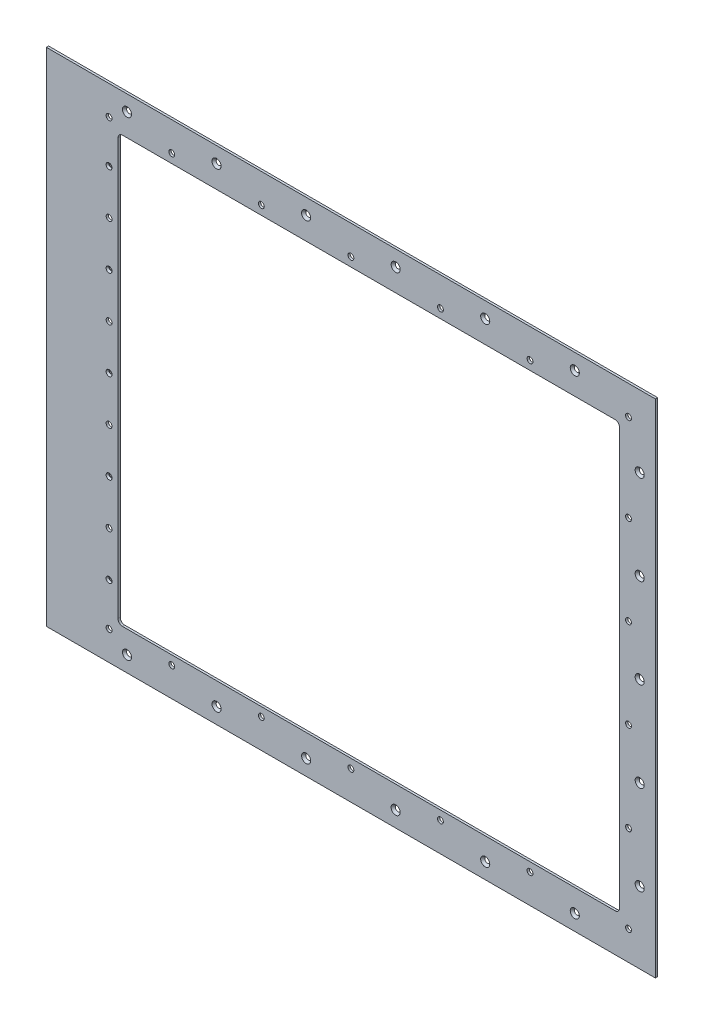
from build123d import *

# Parameters (mm, degrees)
SKETCH2_W                        = 863.6
SKETCH2_H                        = 711.2
BOSS_EXTRUDE1_DEPTH              = 3.175
SKETCH3_W                        = 711.2
SKETCH3_H                        = 603.25
CUT_EXTRUDE2_DEPTH               = 1119.758454996
LPATTERN1_COUNT                  = 6
LPATTERN1_PITCH                  = 127
LPATTERN1_COUNT_DIR2             = 2
LPATTERN1_PITCH_DIR2             = 666.75
LPATTERN2_COUNT                  = 5
LPATTERN2_PITCH                  = 127
FILLET1_R                        = 6.35
F_21_64_0_32813_DIAMETER_HOLE1_D = 8.334502
LPATTERN4_COUNT                  = 2
LPATTERN4_PITCH                  = 736.6
LPATTERN4_COUNT_DIR2             = 2
LPATTERN4_PITCH_DIR2             = 628.65
F_21_64_0_32813_DIAMETER_HOLE2_D = 8.334502
LPATTERN5_COUNT                  = 5
LPATTERN5_PITCH                  = 127
LPATTERN5_COUNT_DIR2             = 2
LPATTERN5_PITCH_DIR2             = 628.65
F_21_64_0_32813_DIAMETER_HOLE3_D = 8.334502
LPATTERN6_COUNT                  = 4
LPATTERN6_PITCH                  = 127
LPATTERN6_COUNT_DIR2             = 2
LPATTERN6_PITCH_DIR2             = 736.6
LPATTERN7_COUNT                  = 5
LPATTERN7_PITCH                  = 127


with BuildPart() as part:
    # Sketch2 → Boss-Extrude1 (new body)
    with BuildSketch(Plane.XY):
        with Locations((431.8, 355.6)):
            Rectangle(SKETCH2_W, SKETCH2_H)
    extrude(amount=BOSS_EXTRUDE1_DEPTH)

    # Sketch3 → Cut-Extrude2 (cut, through all)
    with BuildSketch(Plane.XY.offset(3.175)):
        with Locations((457.2, 355.6)):
            Rectangle(SKETCH3_W, SKETCH3_H)
    extrude(amount=-CUT_EXTRUDE2_DEPTH, mode=Mode.SUBTRACT)

    # Sketch5 → CSK for 1/4 Flat Head Machine Screw1 (revolve, cut)
    with BuildSketch(Plane(origin=(114.3, 22.225, 3.175), x_dir=(0, -1, 0), z_dir=(1, 0, 0))):
        Polygon((0, 0), (0, 3.175), (3.57124, 3.175), (3.57124, 3.298865467), (6.4389, 0), align=None)
    csk_for_1_4_flat_head_machine_screw1 = revolve(axis=Axis((114.3, 22.225, 9.525), (0, 0, -1)), mode=Mode.SUBTRACT)

    # LPattern1: CSK for 1_4 Flat Head Machine Screw1 6 × 2
    with Locations(*[(i * LPATTERN1_PITCH, j * LPATTERN1_PITCH_DIR2, 0) for i in range(LPATTERN1_COUNT) for j in range(LPATTERN1_COUNT_DIR2) if (i, j) != (0, 0)]):
        add(csk_for_1_4_flat_head_machine_screw1, mode=Mode.SUBTRACT)

    # Sketch7 → CSK for 1/4 Flat Head Machine Screw2 (revolve, cut)
    with BuildSketch(Plane(origin=(841.375, 101.6, 3.175), x_dir=(0, -1, 0), z_dir=(1, 0, 0))):
        Polygon((0, 0), (0, 3.175), (3.57124, 3.175), (3.57124, 3.298865467), (6.4389, 0), align=None)
    csk_for_1_4_flat_head_machine_screw2 = revolve(axis=Axis((841.375, 101.6, 9.525), (0, 0, -1)), mode=Mode.SUBTRACT)

    # LPattern2: CSK for 1/4 Flat Head Machine Screw2 ×5
    with Locations(*[(0, i * LPATTERN2_PITCH, 0) for i in range(1, LPATTERN2_COUNT)]):
        add(csk_for_1_4_flat_head_machine_screw2, mode=Mode.SUBTRACT)

    # Fillet1
    fillet1_edges = [part.edges().sort_by_distance(p)[0] for p in [
        (101.6, 53.975, 1.5875),
        (101.6, 657.225, 1.5875),
        (812.8, 657.225, 1.5875),
        (812.8, 53.975, 1.5875),
    ]]
    fillet(fillet1_edges, radius=FILLET1_R)

    # 21/64 (0.32813) Diameter Hole1 (through all)
    with Locations(Plane.XY.offset(3.175)):
        with Locations((825.5, 41.275)):
            f_21_64_0_32813_diameter_hole1 = Hole(F_21_64_0_32813_DIAMETER_HOLE1_D / 2)

    # LPattern4: 21_64 _0.32813_ Diameter Hole1 2 × 2
    with Locations(*[(-i * LPATTERN4_PITCH, j * LPATTERN4_PITCH_DIR2, 0) for i in range(LPATTERN4_COUNT) for j in range(LPATTERN4_COUNT_DIR2) if (i, j) != (0, 0)]):
        add(f_21_64_0_32813_diameter_hole1, mode=Mode.SUBTRACT)

    # 21/64 (0.32813) Diameter Hole2 (through all)
    with Locations(Plane.XY.offset(3.175)):
        with Locations((685.8, 41.275)):
            f_21_64_0_32813_diameter_hole2 = Hole(F_21_64_0_32813_DIAMETER_HOLE2_D / 2)

    # LPattern5: 21_64 _0.32813_ Diameter Hole2 5 × 2
    with Locations(*[(-i * LPATTERN5_PITCH, j * LPATTERN5_PITCH_DIR2, 0) for i in range(LPATTERN5_COUNT) for j in range(LPATTERN5_COUNT_DIR2) if (i, j) != (0, 0)]):
        add(f_21_64_0_32813_diameter_hole2, mode=Mode.SUBTRACT)

    # 21/64 (0.32813) Diameter Hole3 (through all)
    with Locations(Plane.XY.offset(3.175)):
        with Locations((825.5, 165.1)):
            f_21_64_0_32813_diameter_hole3 = Hole(F_21_64_0_32813_DIAMETER_HOLE3_D / 2)

    # LPattern6: 21_64 _0.32813_ Diameter Hole3 4 × 2
    with Locations(*[(-j * LPATTERN6_PITCH_DIR2, i * LPATTERN6_PITCH, 0) for i in range(LPATTERN6_COUNT) for j in range(LPATTERN6_COUNT_DIR2) if (i, j) != (0, 0)]):
        add(f_21_64_0_32813_diameter_hole3, mode=Mode.SUBTRACT)

    # Sketch17 → CSK for #8 Flat Head Machine Screw1 (revolve, cut)
    with BuildSketch(Plane(origin=(88.9, 609.6, 3.175), x_dir=(0, -1, 0), z_dir=(1, 0, 0))):
        Polygon((0, 0), (0, 3.175), (2.2479, 3.175), (2.2479, 2.26450021), (4.2164, 0), align=None)
    csk_for_8_flat_head_machine_screw1 = revolve(axis=Axis((88.9, 609.6, 9.525), (0, 0, -1)), mode=Mode.SUBTRACT)

    # LPattern7: CSK for #8 Flat Head Machine Screw1 ×5
    with Locations(*[(0, -i * LPATTERN7_PITCH, 0) for i in range(1, LPATTERN7_COUNT)]):
        add(csk_for_8_flat_head_machine_screw1, mode=Mode.SUBTRACT)


solid = part.part
